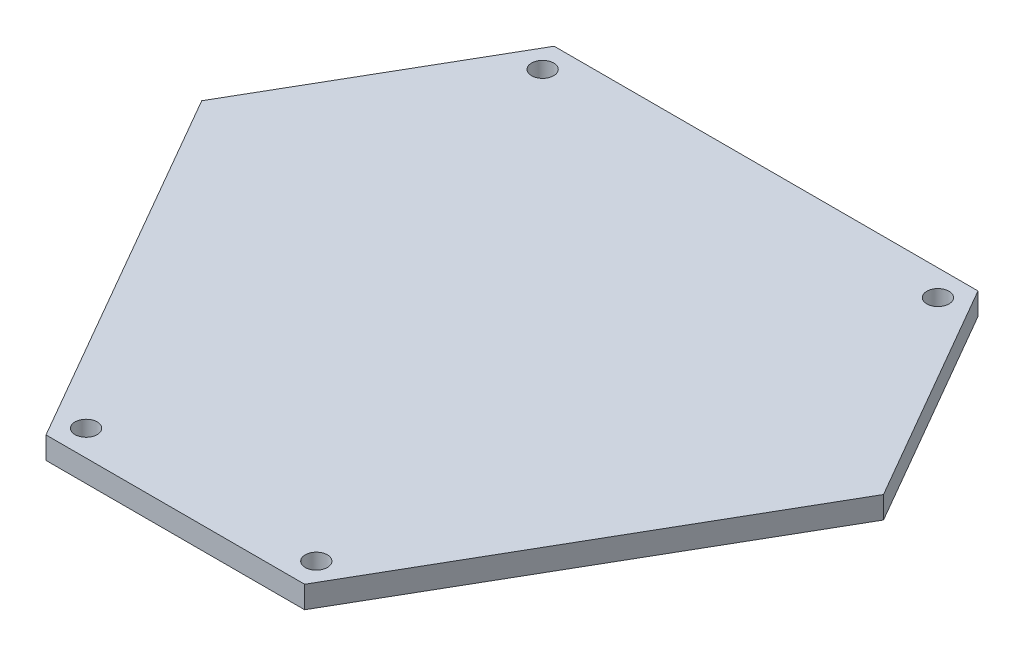
from build123d import *

# Parameters (mm, degrees)
RESSALTO_EXTRUS_O1_DEPTH = 3
CORTE_EXTRUS_O2_DEPTH    = 151.026697624
ESBO_O5_R                = 1.5
CORTE_EXTRUS_O3_DEPTH    = 93.556406403


with BuildPart() as part:
    # Esboço1 → Ressalto-extrusão1 (new body)
    with BuildSketch(Plane(origin=(0, 0, 0), x_dir=(1, 0, 0), z_dir=(0, 1, 0))):
        Polygon((-75, 0), (75, 0), (0, 129.9), align=None)
    extrude(amount=RESSALTO_EXTRUS_O1_DEPTH)

    # Esboço4 → Corte-extrusão2 (cut, through all)
    with BuildSketch(Plane(origin=(0, 3, 0), x_dir=(1, 0, 0), z_dir=(0, 1, 0))):
        Polygon((-28.742601802, 80.117813679), (28.742601802, 80.117813679), (0, 129.9), align=None)
        Polygon((-46.239258354, 49.813604531), (-17.548607665, 0), (-75, 0), align=None)
        Polygon((17.532230415, 0), (75, 0), (46.247424766, 49.799460305), align=None)
    extrude(amount=-CORTE_EXTRUS_O2_DEPTH, mode=Mode.SUBTRACT)

    # Esboço5 → Corte-extrusão3 (cut, through all)
    with BuildSketch(Plane(origin=(0, 3, 0), x_dir=(1, 0, 0), z_dir=(0, 1, 0))):
        with Locations(Location((-26.806110129, 76.617813679, 0), (0, 0, 270))):
            Circle(ESBO_O5_R)
        with Locations(Location((26.806110129, 76.617813679, 0), (0, 0, 90))):
            Circle(ESBO_O5_R)
        with Locations(Location((-15.612115992, 3.5, 0), (0, 0, 270))):
            Circle(ESBO_O5_R)
        with Locations(Location((15.612115992, 3.5, 0), (0, 0, 90))):
            Circle(ESBO_O5_R)
    extrude(amount=-CORTE_EXTRUS_O3_DEPTH, mode=Mode.SUBTRACT)


solid = part.part
